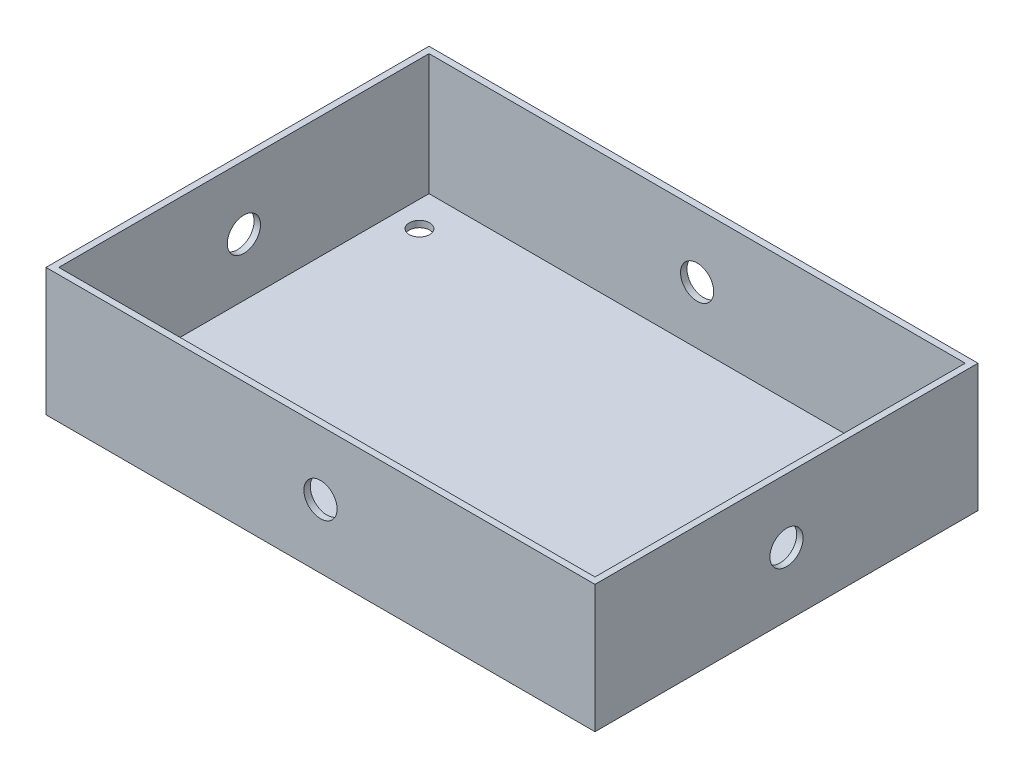
from build123d import *

# Parameters (mm, degrees)
SKETCH_1_W          = 86
SKETCH_1_H          = 60
EXTRUDE_1_DEPTH     = 20
SKETCH_2_W          = 84
SKETCH_2_H          = 58
CUT_EXTRUDE_1_DEPTH = 19
SKETCH_3_R          = 1.6
CUT_EXTRUDE_2_DEPTH = 1
SKETCH_4_R          = 2.6
CUT_EXTRUDE_3_DEPTH = 94.252345815
SKETCH_5_R          = 2.6
CUT_EXTRUDE_4_DEPTH = 77.47875522


with BuildPart() as part:
    # 草图1 → 凸台-拉伸1 (new body)
    with BuildSketch(Plane(origin=(0, 0, 0), x_dir=(1, 0, 0), z_dir=(0, 1, 0))):
        Rectangle(SKETCH_1_W, SKETCH_1_H)
    extrude(amount=EXTRUDE_1_DEPTH)

    # 草图2 → 切除-拉伸1 (cut)
    with BuildSketch(Plane(origin=(0, 20, 0), x_dir=(1, 0, 0), z_dir=(0, 1, 0))):
        Rectangle(SKETCH_2_W, SKETCH_2_H)
    extrude(amount=-CUT_EXTRUDE_1_DEPTH, mode=Mode.SUBTRACT)

    # 草图3 → 切除-拉伸2 (cut)
    with BuildSketch(Plane.XZ):
        with Locations(Location((-38, 23.5, 0), (0, 0, 270))):
            Circle(SKETCH_3_R)
        with Locations(Location((38, 23.5, 0), (0, 0, 90))):
            Circle(SKETCH_3_R)
        with Locations(Location((38, -23.5, 0), (0, 0, 270))):
            Circle(SKETCH_3_R)
        with Locations(Location((-38, -23.5, 0), (0, 0, 90))):
            Circle(SKETCH_3_R)
    extrude(amount=-CUT_EXTRUDE_2_DEPTH, mode=Mode.SUBTRACT)

    # 草图4 → 切除-拉伸3 (cut, through all)
    with BuildSketch(Plane.ZY.offset(43)):
        with Locations((0, 10)):
            Circle(SKETCH_4_R)
    extrude(amount=-CUT_EXTRUDE_3_DEPTH, mode=Mode.SUBTRACT)

    # 草图5 → 切除-拉伸4 (cut, through all)
    with BuildSketch(Plane(origin=(0, 0, -30), x_dir=(-1, 0, 0), z_dir=(0, 0, -1))):
        with Locations((0, 10)):
            Circle(SKETCH_5_R)
    extrude(amount=-CUT_EXTRUDE_4_DEPTH, mode=Mode.SUBTRACT)


solid = part.part
